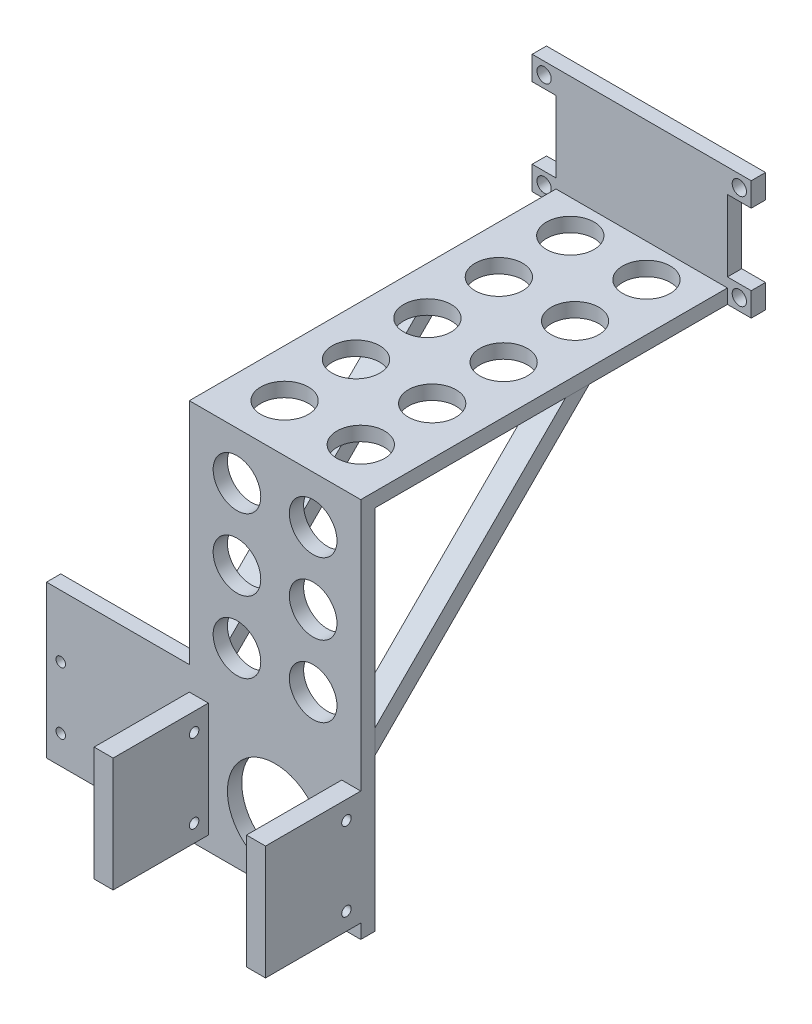
from build123d import *

# Parameters (mm, degrees)
SKETCH_1_W          = 36
SKETCH_1_H          = 25
EXTRUDE_1_DEPTH     = 3
SKETCH_2_W          = 36
SKETCH_2_H          = 3
EXTRUDE_2_DEPTH     = 77
SKETCH_3_W          = 36
SKETCH_3_H          = 3
EXTRUDE_3_DEPTH     = 77
SKETCH_4_R          = 10
CUT_EXTRUDE_1_DEPTH = 77
SKETCH_8_W          = 4
SKETCH_8_H          = 24
EXTRUDE_4_DEPTH     = 20
SKETCH_12_W         = 3
SKETCH_12_H         = 5
EXTRUDE_5_DEPTH     = 5
SKETCH_13_W         = 3
SKETCH_13_H         = 5
EXTRUDE_6_DEPTH     = 5
SKETCH_14_R         = 1.5
CUT_EXTRUDE_4_DEPTH = 134.971078969
EXTRUDE_7_DEPTH     = 5
EXTRUDE_8_DEPTH     = 5
SKETCH_9_R          = 1
CUT_EXTRUDE_5_DEPTH = 141.32551443
SKETCH_18_R         = 5
CUT_EXTRUDE_6_DEPTH = 5
SKETCH_19_R         = 5
CUT_EXTRUDE_7_DEPTH = 5
SKETCH_20_W         = 3
SKETCH_20_H         = 32
EXTRUDE_9_DEPTH     = 30
SKETCH_21_R         = 1
CUT_EXTRUDE_8_DEPTH = 10


with BuildPart() as part:
    # 草图1 → 凸台-拉伸1 (new body)
    with BuildSketch(Plane.XY):
        Rectangle(SKETCH_1_W, SKETCH_1_H)
    extrude(amount=EXTRUDE_1_DEPTH)

    # 草图2 → 凸台-拉伸2 (add)
    with BuildSketch(Plane.XY.offset(3)):
        with Locations((0, -11)):
            Rectangle(SKETCH_2_W, SKETCH_2_H)
    extrude(amount=EXTRUDE_2_DEPTH)

    # 草图3 → 凸台-拉伸3 (add)
    with BuildSketch(Plane.XZ.offset(12.5)):
        with Locations((0, 78.5)):
            Rectangle(SKETCH_3_W, SKETCH_3_H)
    extrude(amount=EXTRUDE_3_DEPTH)

    # 草图4 → 切除-拉伸1 (cut)
    with BuildSketch(Plane.XY.offset(80)):
        with Locations((0, -76.5)):
            Circle(SKETCH_4_R)
    extrude(amount=-CUT_EXTRUDE_1_DEPTH, mode=Mode.SUBTRACT)

    # 草图8 → 凸台-拉伸4 (add)
    with BuildSketch(Plane.XY.offset(80)):
        with Locations((16, -74.5)):
            Rectangle(SKETCH_8_W, SKETCH_8_H)
        with Locations((-16, -74.5)):
            Rectangle(SKETCH_8_W, SKETCH_8_H)
    extrude(amount=EXTRUDE_4_DEPTH)

    # 草图12 → 凸台-拉伸5 (add)
    with BuildSketch(Plane(origin=(18, 0, 0), x_dir=(0, 0, -1), z_dir=(1, 0, 0))):
        with Locations((-1.5, 10)):
            Rectangle(SKETCH_12_W, SKETCH_12_H)
        with Locations((-1.5, -10)):
            Rectangle(SKETCH_12_W, SKETCH_12_H)
    extrude(amount=EXTRUDE_5_DEPTH)

    # 草图13 → 凸台-拉伸6 (add)
    with BuildSketch(Plane.ZY.offset(18)):
        with Locations((1.5, 10)):
            Rectangle(SKETCH_13_W, SKETCH_13_H)
        with Locations((1.5, -10)):
            Rectangle(SKETCH_13_W, SKETCH_13_H)
    extrude(amount=EXTRUDE_6_DEPTH)

    # 草图14 → 切除-拉伸4 (cut, through all)
    with BuildSketch(Plane.XY.offset(3)):
        with Locations((-20.5, 10)):
            Circle(SKETCH_14_R)
        with Locations(Location((20.5, 10, 0), (0, 0, 180))):
            Circle(SKETCH_14_R)
        with Locations((20.5, -10)):
            Circle(SKETCH_14_R)
        with Locations(Location((-20.5, -10, 0), (0, 0, 180))):
            Circle(SKETCH_14_R)
    extrude(amount=-CUT_EXTRUDE_4_DEPTH, mode=Mode.SUBTRACT)

    # 草图15 → 凸台-拉伸7 (add)
    with BuildSketch(Plane.ZY.offset(18)):
        Polygon((77, -52.5), (37, -12.5), (32, -12.5), (77, -57.5), align=None)
    extrude(amount=-EXTRUDE_7_DEPTH)

    # 草图9 → 切除-拉伸5 (cut, through all)
    with BuildSketch(Plane.ZY.offset(18)):
        with Locations((83, -82.85)):
            Circle(SKETCH_9_R)
        with Locations((83, -66.35)):
            Circle(SKETCH_9_R)
    extrude(amount=-CUT_EXTRUDE_5_DEPTH, mode=Mode.SUBTRACT)

    # 草图18 → 切除-拉伸6 (cut)
    with BuildSketch(Plane.XY.offset(80)):
        with Locations((-8, -19.5)):
            Circle(SKETCH_18_R)
        with Locations((8, -19.5)):
            Circle(SKETCH_18_R)
        with Locations((-8, -34.5)):
            Circle(SKETCH_18_R)
        with Locations((8, -34.5)):
            Circle(SKETCH_18_R)
        with Locations((-8, -49.5)):
            Circle(SKETCH_18_R)
        with Locations((8, -49.5)):
            Circle(SKETCH_18_R)
    extrude(amount=-CUT_EXTRUDE_6_DEPTH, mode=Mode.SUBTRACT)

    # 草图19 → 切除-拉伸7 (cut)
    with BuildSketch(Plane(origin=(0, -9.5, 0), x_dir=(1, 0, 0), z_dir=(0, 1, 0))):
        with Locations(Location((-8, -70, 0), (0, 0, 270))):
            Circle(SKETCH_19_R)
        with Locations(Location((8, -70, 0), (0, 0, 270))):
            Circle(SKETCH_19_R)
        with Locations(Location((-8, -55, 0), (0, 0, 270))):
            Circle(SKETCH_19_R)
        with Locations(Location((8, -55, 0), (0, 0, 270))):
            Circle(SKETCH_19_R)
        with Locations(Location((-8, -40, 0), (0, 0, 270))):
            Circle(SKETCH_19_R)
        with Locations(Location((8, -40, 0), (0, 0, 270))):
            Circle(SKETCH_19_R)
        with Locations(Location((-8, -25, 0), (0, 0, 270))):
            Circle(SKETCH_19_R)
        with Locations(Location((8, -25, 0), (0, 0, 270))):
            Circle(SKETCH_19_R)
        with Locations(Location((-8, -10, 0), (0, 0, 270))):
            Circle(SKETCH_19_R)
        with Locations(Location((8, -10, 0), (0, 0, 270))):
            Circle(SKETCH_19_R)
    extrude(amount=-CUT_EXTRUDE_7_DEPTH, mode=Mode.SUBTRACT)

    # 草图20 → 凸台-拉伸9 (add)
    with BuildSketch(Plane.ZY.offset(18)):
        with Locations((78.5, -73.5)):
            Rectangle(SKETCH_20_W, SKETCH_20_H)
    extrude(amount=EXTRUDE_9_DEPTH)

    # 草图21 → 切除-拉伸8 (cut)
    with BuildSketch(Plane(origin=(0, 0, 77), x_dir=(-1, 0, 0), z_dir=(0, 0, -1))):
        with Locations((24, -70.5)):
            Circle(SKETCH_21_R)
        with Locations((45, -70.5)):
            Circle(SKETCH_21_R)
        with Locations((24, -83.5)):
            Circle(SKETCH_21_R)
        with Locations((45, -83.5)):
            Circle(SKETCH_21_R)
    extrude(amount=-CUT_EXTRUDE_8_DEPTH, mode=Mode.SUBTRACT)


with BuildPart() as body_2:
    # 草图16 → 凸台-拉伸8 (new body)
    with BuildSketch(Plane(origin=(18, 0, 0), x_dir=(0, 0, -1), z_dir=(1, 0, 0))):
        Polygon((-77, -52.5), (-77, -57.5), (-32, -12.5), (-37, -12.5), align=None)
    extrude(amount=-EXTRUDE_8_DEPTH)


solid = Compound([part.part, body_2.part])
